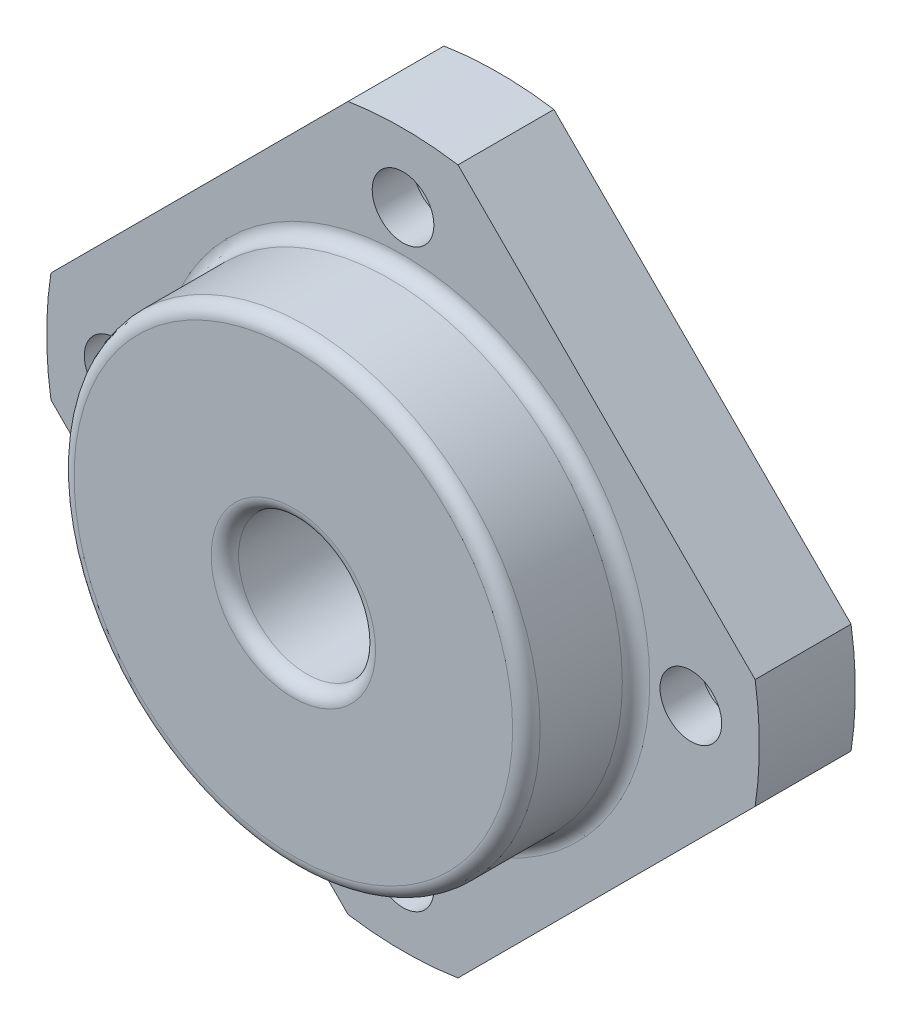
from build123d import *

# Parameters (mm, degrees)
BOSS_EXTRUDE1_DEPTH = 7
SKETCH2_R           = 4
CUT_EXTRUDE1_DEPTH  = 4
SKETCH3_R           = 2.25
CUT_EXTRUDE2_DEPTH  = 4
SKETCH4_R           = 17
BOSS_EXTRUDE2_DEPTH = 8
SKETCH5_R           = 5
CUT_EXTRUDE3_DEPTH  = 15
FILLET3_R           = 1


with BuildPart() as part:
    # Sketch1 → Boss-Extrude1 (new body)
    with BuildSketch(Plane.XY):
        with BuildLine():
            Line((-14.849242405, -14.849242405), (-25.688984099, -4.009500711))
            ThreePointArc((-25.688984099, -4.009500711), (-26, 0), (-25.688984099, 4.009500711))
            Line((-25.688984099, 4.009500711), (-14.849242405, 14.849242405))
            Line((-14.849242405, 14.849242405), (-4.009500711, 25.688984099))
            ThreePointArc((-4.009500711, 25.688984099), (0, 26), (4.009500711, 25.688984099))
            Line((4.009500711, 25.688984099), (14.849242405, 14.849242405))
            Line((14.849242405, 14.849242405), (25.688984099, 4.009500711))
            ThreePointArc((25.688984099, 4.009500711), (26, 0), (25.688984099, -4.009500711))
            Line((25.688984099, -4.009500711), (14.849242405, -14.849242405))
            Line((14.849242405, -14.849242405), (4.009500711, -25.688984099))
            ThreePointArc((4.009500711, -25.688984099), (0, -26), (-4.009500711, -25.688984099))
            Line((-4.009500711, -25.688984099), (-14.849242405, -14.849242405))
        make_face()
    extrude(amount=BOSS_EXTRUDE1_DEPTH)

    # Sketch2 → Cut-Extrude1 (cut)
    with BuildSketch(Plane(origin=(0, 0, 0), x_dir=(-1, 0, 0), z_dir=(0, 0, -1))):
        with Locations((0, 21)):
            Circle(SKETCH2_R)
        with Locations((-21, 0)):
            Circle(SKETCH2_R)
        with Locations((0, -21)):
            Circle(SKETCH2_R)
        with Locations((21, 0)):
            Circle(SKETCH2_R)
    extrude(amount=-CUT_EXTRUDE1_DEPTH, mode=Mode.SUBTRACT)

    # Sketch3 → Cut-Extrude2 (cut)
    with BuildSketch(Plane(origin=(0, 0, 4), x_dir=(-1, 0, 0), z_dir=(0, 0, -1))):
        with Locations((0, 21)):
            Circle(SKETCH3_R)
        with Locations((-21, 0)):
            Circle(SKETCH3_R)
        with Locations((21, 0)):
            Circle(SKETCH3_R)
        with Locations((0, -21)):
            Circle(SKETCH3_R)
    extrude(amount=-CUT_EXTRUDE2_DEPTH, mode=Mode.SUBTRACT)

    # Sketch4 → Boss-Extrude2 (add)
    with BuildSketch(Plane.XY.offset(7)):
        Circle(SKETCH4_R)
    extrude(amount=BOSS_EXTRUDE2_DEPTH)

    # Sketch5 → Cut-Extrude3 (cut)
    with BuildSketch(Plane.XY.offset(15)):
        Circle(SKETCH5_R)
    extrude(amount=-CUT_EXTRUDE3_DEPTH, mode=Mode.SUBTRACT)

    # Fillet3
    fillet3_edges = [part.edges().sort_by_distance(p)[0] for p in [
        (-17, 0, 7),
        (-17, 0, 15),
        (-5, 0, 15),
    ]]
    fillet(fillet3_edges, radius=FILLET3_R)


solid = part.part
